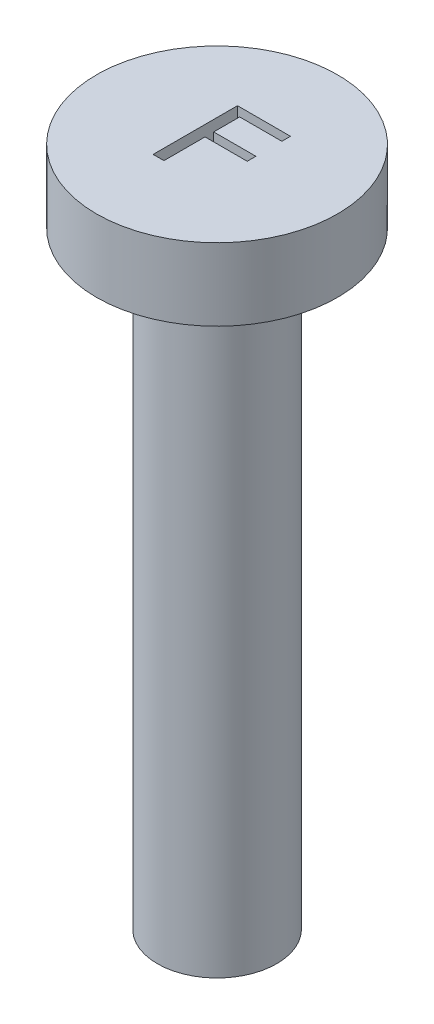
from build123d import *

# Parameters (mm, degrees)
SKETCH1_R                    = 2.475
BOSS_EXTRUDE1_DEPTH          = 25.2
SKETCH2_R                    = 5
BOSS_EXTRUDE2_DEPTH          = 3
M2_5X0_45_TAPPED_HOLE2_D     = 2.05
M2_5X0_45_TAPPED_HOLE2_DEPTH = 7.25
M2_5X0_45_TAPPED_HOLE2_TIP   = 0.615882135
CUT_EXTRUDE1_DEPTH           = 1


with BuildPart() as part:
    # Sketch1 → Boss-Extrude1 (new body)
    with BuildSketch(Plane(origin=(0, 0, 0), x_dir=(1, 0, 0), z_dir=(0, 1, 0))):
        with Locations(Location((0, 0, 0), (0, 0, 270))):
            Circle(SKETCH1_R)
    extrude(amount=BOSS_EXTRUDE1_DEPTH)

    # Sketch2 → Boss-Extrude2 (add)
    with BuildSketch(Plane(origin=(0, 25.2, 0), x_dir=(1, 0, 0), z_dir=(0, 1, 0))):
        with Locations(Location((0, 0, 0), (0, 0, 270))):
            Circle(SKETCH2_R)
    extrude(amount=BOSS_EXTRUDE2_DEPTH)

    # M2.5x0.45 Tapped Hole2
    with Locations(Plane(origin=(0, 0, 0), x_dir=(-1, 0, 0), z_dir=(0, -1, 0))):
        with Locations((0, 0)):
            Hole(M2_5X0_45_TAPPED_HOLE2_D / 2, depth=M2_5X0_45_TAPPED_HOLE2_DEPTH)
            with Locations((0, 0, -(M2_5X0_45_TAPPED_HOLE2_DEPTH + M2_5X0_45_TAPPED_HOLE2_TIP / 2))):  # 118° drill point
                Cone(0, M2_5X0_45_TAPPED_HOLE2_D / 2, M2_5X0_45_TAPPED_HOLE2_TIP, mode=Mode.SUBTRACT)

    # Sketch15 → Cut-Extrude1 (cut)
    with BuildSketch(Plane(origin=(0, 28.2, 0), x_dir=(1, 0, 0), z_dir=(0, 1, 0))):
        Polygon((-0.96474359, 1.812951114), (1.233974359, 1.812951114), (1.233974359, 1.453976755), (-0.516025641, 1.453976755), (-0.516025641, 0.377053678), (1.233974359, 0.377053678), (1.233974359, 0.018079319), (-0.516025641, 0.018079319), (-0.516025641, -1.687048886), (-0.96474359, -1.687048886), align=None)
    extrude(amount=-CUT_EXTRUDE1_DEPTH, mode=Mode.SUBTRACT)


solid = part.part
